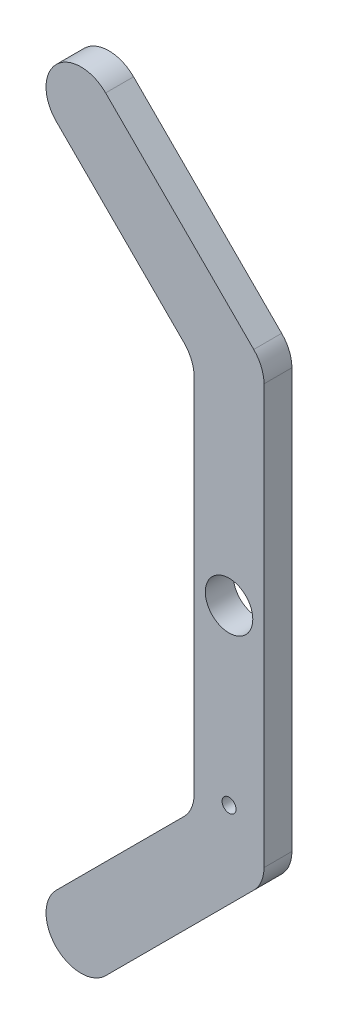
from build123d import *

# Parameters (mm, degrees)
SKETCH1_R           = 0.5
SKETCH1_R_2         = 1.7
BOSS_EXTRUDE1_DEPTH = 2
FILLET1_R           = 2.5


with BuildPart() as part:
    # Sketch1 → Boss-Extrude1 (new body)
    with BuildSketch(Plane.XY):
        with BuildLine():
            Line((-8.838834765, -35.374368671), (1.767766953, -24.767766953))
            ThreePointArc((1.767766953, -24.767766953), (2.309698831, -23.956708581), (2.5, -23))
            Line((2.5, -23), (2.5, 7))
            ThreePointArc((2.5, 7), (2.309698831, 7.956708581), (1.767766953, 8.767766953))
            Line((1.767766953, 8.767766953), (-8.838834765, 19.374368671))
            ThreePointArc((-8.838834765, 19.374368671), (-12.374368671, 19.374368671), (-12.374368671, 15.838834765))
            Line((-12.374368671, 15.838834765), (-2.5, 5.964466094))
            Line((-2.5, 5.964466094), (-2.5, -21.964466094))
            Line((-2.5, -21.964466094), (-12.374368671, -31.838834765))
            ThreePointArc((-12.374368671, -31.838834765), (-12.374368671, -35.374368671), (-8.838834765, -35.374368671))
        make_face()
        with Locations((0, -20.379081878)):
            Circle(SKETCH1_R, mode=Mode.SUBTRACT)
        with Locations((0, -8)):
            Circle(SKETCH1_R_2, mode=Mode.SUBTRACT)
    extrude(amount=BOSS_EXTRUDE1_DEPTH)

    # Fillet1
    fillet1_edges = [part.edges().sort_by_distance(p)[0] for p in [
        (-2.5, 5.964466094, 1),
        (-2.5, -21.964466094, 1),
    ]]
    fillet(fillet1_edges, radius=FILLET1_R)


solid = part.part
